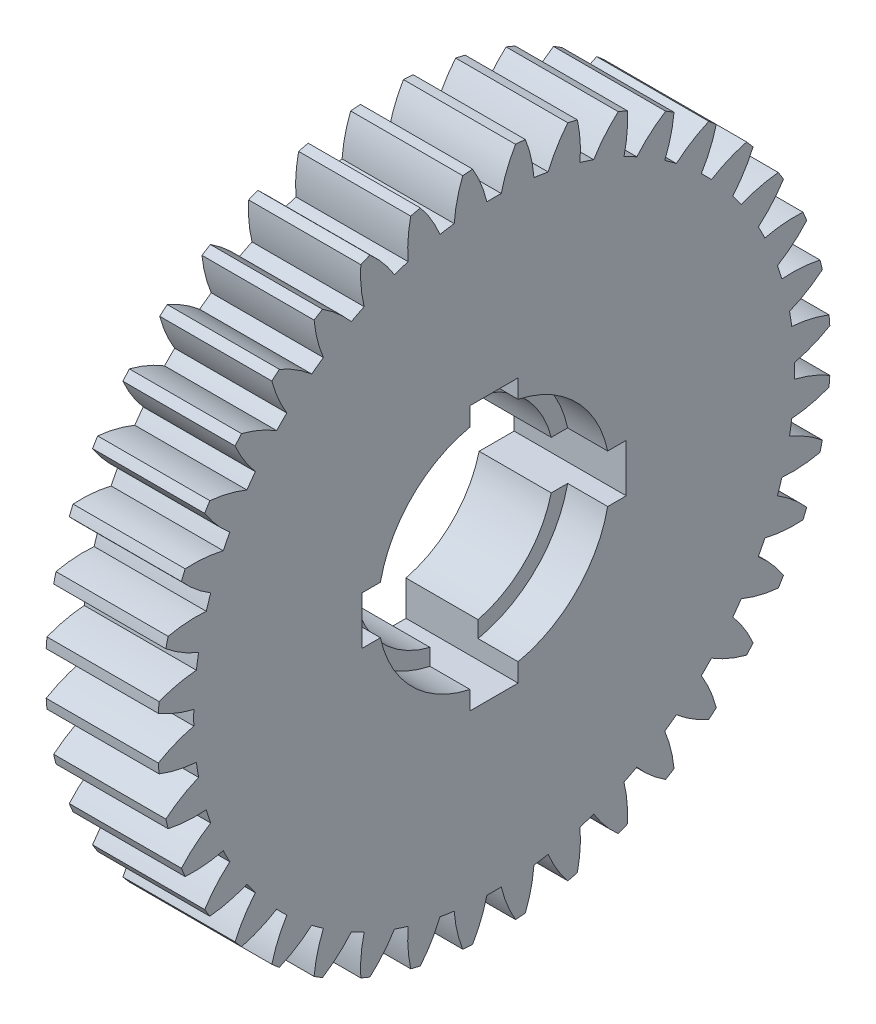
from build123d import *
from build123d.topology import SkipClean

# Parameters (mm, degrees)
BASPROSKE_W             = 8
BASPROSKE_H             = 21
TOOTHCUT_DEPTH          = 31.757112998
TEETHCUTS_COUNT         = 40
BORSKE_R                = 2.5
BORE_DEPTH              = 50.0000508
SKETCH1_R               = 30.395157115
CUT_EXTRUDE1_DEPTH      = 3
BOSS_EXTRUDE1_DEPTH     = 2
CUT_EXTRUDE2_DEPTH      = 31.056738792
CUT_EXTRUDE2_DEPTH_BACK = 31.056738792
CUT_EXTRUDE3_DEPTH      = 0.5
CUT_EXTRUDE3_DEPTH_BACK = 2
SKETCH3_R               = 7.25


with BuildPart() as part:
    # BasProSke → Base-Revolve (revolve)
    with BuildSketch(Plane(origin=(0, 0, 0), x_dir=(1, 0, 0), z_dir=(0, 1, 0))):
        with Locations((4, 10.5)):
            Rectangle(BASPROSKE_W, BASPROSKE_H)
    revolve(axis=Axis((-10, 0, 0), (1, 0, 0)))

    # TooCutSke → ToothCut (cut, through all)
    with BuildSketch(Plane(origin=(0, 0, 0), x_dir=(0, 0, -1), z_dir=(1, 0, 0))):
        with BuildLine():
            ThreePointArc((0.448673268, 18.74363074), (0, 18.749), (-0.448673268, 18.74363074))
            ThreePointArc((-0.448673268, 18.74363074), (-0.816786816, 19.89705013), (-1.354745081, 20.981708961))
            ThreePointArc((-1.354745081, 20.981708961), (0, 21.0254), (1.354745081, 20.981708961))
            ThreePointArc((1.354745081, 20.981708961), (0.816786816, 19.89705013), (0.448673268, 18.74363074))
        make_face()
    toothcut = extrude(amount=TOOTHCUT_DEPTH, mode=Mode.SUBTRACT)

    # TeethCuts: ToothCut ×40 about axis
    teethcuts_axis = Axis((-10, 0, 0), (1, 0, 0))
    for i in range(1, TEETHCUTS_COUNT):
        add(toothcut.rotate(teethcuts_axis, i * 360 / TEETHCUTS_COUNT), mode=Mode.SUBTRACT)

    # BorSke → Bore (cut, symmetric)
    with BuildSketch(Plane(origin=(0, 0, 0), x_dir=(0, 0, -1), z_dir=(1, 0, 0))):
        Circle(BORSKE_R)
    extrude(amount=BORE_DEPTH, both=True, mode=Mode.SUBTRACT)

    # Sketch1 → Cut-Extrude1 (cut)
    with BuildSketch(Plane(origin=(8, 0, 0), x_dir=(0, 0, -1), z_dir=(1, 0, 0))):
        with Locations((-0.364084054, 0)):
            Circle(SKETCH1_R)
    extrude(amount=-CUT_EXTRUDE1_DEPTH, mode=Mode.SUBTRACT)

    # Sketch4 → Boss-Extrude1 (add)
    with SkipClean():  # the faces are left unmerged after this step: merging them gives an invalid solid
        with BuildSketch(Plane(origin=(5, 0, 0), x_dir=(0, 0, -1), z_dir=(1, 0, 0))):
            with BuildLine():
                ThreePointArc((-20.908830043, 1.954693382), (-20.935264008, 1.64764101), (-20.957189063, 1.34023378))
                ThreePointArc((-20.957189063, 1.34023378), (-19.883840387, 0.811452619), (-18.74363074, 0.448673268))
                ThreePointArc((-18.74363074, 0.448673268), (-18.749, 0), (-18.74363074, -0.448673268))
                ThreePointArc((-18.74363074, -0.448673268), (-19.883840387, -0.811452619), (-20.957189063, -1.34023378))
                ThreePointArc((-20.957189063, -1.34023378), (-20.935264008, -1.64764101), (-20.908830043, -1.954693382))
                ThreePointArc((-20.908830043, -1.954693382), (-19.765976472, -2.309055643), (-18.583053504, -2.489000492))
                ThreePointArc((-18.583053504, -2.489000492), (-18.518168698, -2.932989785), (-18.442677579, -3.375299203))
                ThreePointArc((-18.442677579, -3.375299203), (-19.51209816, -3.911980225), (-20.489512535, -4.602159938))
                ThreePointArc((-20.489512535, -4.602159938), (-20.419768328, -4.902352641), (-20.345626236, -5.201489505))
                ThreePointArc((-20.345626236, -5.201489505), (-19.161408618, -5.372707292), (-17.964899819, -5.3653868))
                ThreePointArc((-17.964899819, -5.3653868), (-17.831358624, -5.793759628), (-17.687604489, -6.21881407))
                ThreePointArc((-17.687604489, -6.21881407), (-18.659903319, -6.916181894), (-19.517316207, -7.750765644))
                ThreePointArc((-19.517316207, -7.750765644), (-19.401470183, -8.03635208), (-19.281445587, -8.320207694))
                ThreePointArc((-19.281445587, -8.320207694), (-18.08502329, -8.304065056), (-16.904390677, -8.109659478))
                ThreePointArc((-16.904390677, -8.109659478), (-16.705481322, -8.51186788), (-16.497003875, -8.909201095))
                ThreePointArc((-16.497003875, -8.909201095), (-17.34823973, -9.750084211), (-18.06453878, -10.708521777))
                ThreePointArc((-18.06453878, -10.708521777), (-17.905443451, -10.972469859), (-17.742491756, -11.234054756))
                ThreePointArc((-17.742491756, -11.234054756), (-16.563324669, -11.030949179), (-15.427639334, -10.654245425))
                ThreePointArc((-15.427639334, -10.654245425), (-15.168259628, -11.020385695), (-14.900192275, -11.380214022))
                ThreePointArc((-14.900192275, -11.380214022), (-15.609404904, -12.343907097), (-16.166952456, -13.402598565))
                ThreePointArc((-16.166952456, -13.402598565), (-15.968525278, -13.638409015), (-15.766658895, -13.871282107))
                ThreePointArc((-15.766658895, -13.871282107), (-14.633782023, -13.486214724), (-13.57100831, -12.93648849))
                ThreePointArc((-13.57100831, -12.93648849), (-13.25754504, -13.25754504), (-12.93648849, -13.57100831))
                ThreePointArc((-12.93648849, -13.57100831), (-13.486214724, -14.633782023), (-13.871282107, -15.766658895))
                ThreePointArc((-13.871282107, -15.766658895), (-13.638409015, -15.968525278), (-13.402598565, -16.166952456))
                ThreePointArc((-13.402598565, -16.166952456), (-12.343907097, -15.609404904), (-11.380214022, -14.900192275))
                ThreePointArc((-11.380214022, -14.900192275), (-11.020385695, -15.168259628), (-10.654245425, -15.427639334))
                ThreePointArc((-10.654245425, -15.427639334), (-11.030949179, -16.563324669), (-11.234054756, -17.742491756))
                ThreePointArc((-11.234054756, -17.742491756), (-10.972469859, -17.905443451), (-10.708521777, -18.06453878))
                ThreePointArc((-10.708521777, -18.06453878), (-9.750084211, -17.34823973), (-8.909201095, -16.497003875))
                ThreePointArc((-8.909201095, -16.497003875), (-8.51186788, -16.705481322), (-8.109659478, -16.904390677))
                ThreePointArc((-8.109659478, -16.904390677), (-8.304065056, -18.08502329), (-8.320207694, -19.281445587))
                ThreePointArc((-8.320207694, -19.281445587), (-8.03635208, -19.401470183), (-7.750765644, -19.517316207))
                ThreePointArc((-7.750765644, -19.517316207), (-6.916181894, -18.659903319), (-6.21881407, -17.687604489))
                ThreePointArc((-6.21881407, -17.687604489), (-5.793759628, -17.831358624), (-5.3653868, -17.964899819))
                ThreePointArc((-5.3653868, -17.964899819), (-5.372707292, -19.161408618), (-5.201489505, -20.345626236))
                ThreePointArc((-5.201489505, -20.345626236), (-4.902352641, -20.419768328), (-4.602159938, -20.489512535))
                ThreePointArc((-4.602159938, -20.489512535), (-3.911980225, -19.51209816), (-3.375299203, -18.442677579))
                ThreePointArc((-3.375299203, -18.442677579), (-2.932989785, -18.518168698), (-2.489000492, -18.583053504))
                ThreePointArc((-2.489000492, -18.583053504), (-2.309055643, -19.765976472), (-1.954693382, -20.908830043))
                ThreePointArc((-1.954693382, -20.908830043), (-1.64764101, -20.935264008), (-1.34023378, -20.957189063))
                ThreePointArc((-1.34023378, -20.957189063), (-0.811452619, -19.883840387), (-0.448673268, -18.74363074))
                ThreePointArc((-0.448673268, -18.74363074), (0, -18.749), (0.448673268, -18.74363074))
                ThreePointArc((0.448673268, -18.74363074), (0.811452619, -19.883840387), (1.34023378, -20.957189063))
                ThreePointArc((1.34023378, -20.957189063), (1.64764101, -20.935264008), (1.954693382, -20.908830043))
                ThreePointArc((1.954693382, -20.908830043), (2.309055643, -19.765976472), (2.489000492, -18.583053504))
                ThreePointArc((2.489000492, -18.583053504), (2.932989785, -18.518168698), (3.375299203, -18.442677579))
                ThreePointArc((3.375299203, -18.442677579), (3.911980225, -19.51209816), (4.602159938, -20.489512535))
                ThreePointArc((4.602159938, -20.489512535), (4.902352641, -20.419768328), (5.201489505, -20.345626236))
                ThreePointArc((5.201489505, -20.345626236), (5.372707292, -19.161408618), (5.3653868, -17.964899819))
                ThreePointArc((5.3653868, -17.964899819), (5.793759628, -17.831358624), (6.21881407, -17.687604489))
                ThreePointArc((6.21881407, -17.687604489), (6.916181894, -18.659903319), (7.750765644, -19.517316207))
                ThreePointArc((7.750765644, -19.517316207), (8.03635208, -19.401470183), (8.320207694, -19.281445587))
                ThreePointArc((8.320207694, -19.281445587), (8.304065056, -18.08502329), (8.109659478, -16.904390677))
                ThreePointArc((8.109659478, -16.904390677), (8.51186788, -16.705481322), (8.909201095, -16.497003875))
                ThreePointArc((8.909201095, -16.497003875), (9.750084211, -17.34823973), (10.708521777, -18.06453878))
                ThreePointArc((10.708521777, -18.06453878), (10.972469859, -17.905443451), (11.234054756, -17.742491756))
                ThreePointArc((11.234054756, -17.742491756), (11.030949179, -16.563324669), (10.654245425, -15.427639334))
                ThreePointArc((10.654245425, -15.427639334), (11.020385695, -15.168259628), (11.380214022, -14.900192275))
                ThreePointArc((11.380214022, -14.900192275), (12.343907097, -15.609404904), (13.402598565, -16.166952456))
                ThreePointArc((13.402598565, -16.166952456), (13.638409015, -15.968525278), (13.871282107, -15.766658895))
                ThreePointArc((13.871282107, -15.766658895), (13.486214724, -14.633782023), (12.93648849, -13.57100831))
                ThreePointArc((12.93648849, -13.57100831), (13.25754504, -13.25754504), (13.57100831, -12.93648849))
                ThreePointArc((13.57100831, -12.93648849), (14.633782023, -13.486214724), (15.766658895, -13.871282107))
                ThreePointArc((15.766658895, -13.871282107), (15.968525278, -13.638409015), (16.166952456, -13.402598565))
                ThreePointArc((16.166952456, -13.402598565), (15.609404904, -12.343907097), (14.900192275, -11.380214022))
                ThreePointArc((14.900192275, -11.380214022), (15.168259628, -11.020385695), (15.427639334, -10.654245425))
                ThreePointArc((15.427639334, -10.654245425), (16.563324669, -11.030949179), (17.742491756, -11.234054756))
                ThreePointArc((17.742491756, -11.234054756), (17.905443451, -10.972469859), (18.06453878, -10.708521777))
                ThreePointArc((18.06453878, -10.708521777), (17.34823973, -9.750084211), (16.497003875, -8.909201095))
                ThreePointArc((16.497003875, -8.909201095), (16.705481322, -8.51186788), (16.904390677, -8.109659478))
                ThreePointArc((16.904390677, -8.109659478), (18.08502329, -8.304065056), (19.281445587, -8.320207694))
                ThreePointArc((19.281445587, -8.320207694), (19.401470183, -8.03635208), (19.517316207, -7.750765644))
                ThreePointArc((19.517316207, -7.750765644), (18.659903319, -6.916181894), (17.687604489, -6.21881407))
                ThreePointArc((17.687604489, -6.21881407), (17.831358624, -5.793759628), (17.964899819, -5.3653868))
                ThreePointArc((17.964899819, -5.3653868), (19.161408618, -5.372707292), (20.345626236, -5.201489505))
                ThreePointArc((20.345626236, -5.201489505), (20.419768328, -4.902352641), (20.489512535, -4.602159938))
                ThreePointArc((20.489512535, -4.602159938), (19.51209816, -3.911980225), (18.442677579, -3.375299203))
                ThreePointArc((18.442677579, -3.375299203), (18.518168698, -2.932989785), (18.583053504, -2.489000492))
                ThreePointArc((18.583053504, -2.489000492), (19.765976472, -2.309055643), (20.908830043, -1.954693382))
                ThreePointArc((20.908830043, -1.954693382), (20.935264008, -1.64764101), (20.957189063, -1.34023378))
                ThreePointArc((20.957189063, -1.34023378), (19.883840387, -0.811452619), (18.74363074, -0.448673268))
                ThreePointArc((18.74363074, -0.448673268), (18.749, 0), (18.74363074, 0.448673268))
                ThreePointArc((18.74363074, 0.448673268), (19.883840387, 0.811452619), (20.957189063, 1.34023378))
                ThreePointArc((20.957189063, 1.34023378), (20.935264008, 1.64764101), (20.908830043, 1.954693382))
                ThreePointArc((20.908830043, 1.954693382), (19.765976472, 2.309055643), (18.583053504, 2.489000492))
                ThreePointArc((18.583053504, 2.489000492), (18.518168698, 2.932989785), (18.442677579, 3.375299203))
                ThreePointArc((18.442677579, 3.375299203), (19.51209816, 3.911980225), (20.489512535, 4.602159938))
                ThreePointArc((20.489512535, 4.602159938), (20.419768328, 4.902352641), (20.345626236, 5.201489505))
                ThreePointArc((20.345626236, 5.201489505), (19.161408618, 5.372707292), (17.964899819, 5.3653868))
                ThreePointArc((17.964899819, 5.3653868), (17.831358624, 5.793759628), (17.687604489, 6.21881407))
                ThreePointArc((17.687604489, 6.21881407), (18.659903319, 6.916181894), (19.517316207, 7.750765644))
                ThreePointArc((19.517316207, 7.750765644), (19.401470183, 8.03635208), (19.281445587, 8.320207694))
                ThreePointArc((19.281445587, 8.320207694), (18.08502329, 8.304065056), (16.904390677, 8.109659478))
                ThreePointArc((16.904390677, 8.109659478), (16.705481322, 8.51186788), (16.497003875, 8.909201095))
                ThreePointArc((16.497003875, 8.909201095), (17.34823973, 9.750084211), (18.06453878, 10.708521777))
                ThreePointArc((18.06453878, 10.708521777), (17.905443451, 10.972469859), (17.742491756, 11.234054756))
                ThreePointArc((17.742491756, 11.234054756), (16.563324669, 11.030949179), (15.427639334, 10.654245425))
                ThreePointArc((15.427639334, 10.654245425), (15.168259628, 11.020385695), (14.900192275, 11.380214022))
                ThreePointArc((14.900192275, 11.380214022), (15.609404904, 12.343907097), (16.166952456, 13.402598565))
                ThreePointArc((16.166952456, 13.402598565), (15.968525278, 13.638409015), (15.766658895, 13.871282107))
                ThreePointArc((15.766658895, 13.871282107), (14.633782023, 13.486214724), (13.57100831, 12.93648849))
                ThreePointArc((13.57100831, 12.93648849), (13.25754504, 13.25754504), (12.93648849, 13.57100831))
                ThreePointArc((12.93648849, 13.57100831), (13.486214724, 14.633782023), (13.871282107, 15.766658895))
                ThreePointArc((13.871282107, 15.766658895), (13.638409015, 15.968525278), (13.402598565, 16.166952456))
                ThreePointArc((13.402598565, 16.166952456), (12.343907097, 15.609404904), (11.380214022, 14.900192275))
                ThreePointArc((11.380214022, 14.900192275), (11.020385695, 15.168259628), (10.654245425, 15.427639334))
                ThreePointArc((10.654245425, 15.427639334), (11.030949179, 16.563324669), (11.234054756, 17.742491756))
                ThreePointArc((11.234054756, 17.742491756), (10.972469859, 17.905443451), (10.708521777, 18.06453878))
                ThreePointArc((10.708521777, 18.06453878), (9.750084211, 17.34823973), (8.909201095, 16.497003875))
                ThreePointArc((8.909201095, 16.497003875), (8.51186788, 16.705481322), (8.109659478, 16.904390677))
                ThreePointArc((8.109659478, 16.904390677), (8.304065056, 18.08502329), (8.320207694, 19.281445587))
                ThreePointArc((8.320207694, 19.281445587), (8.03635208, 19.401470183), (7.750765644, 19.517316207))
                ThreePointArc((7.750765644, 19.517316207), (6.916181894, 18.659903319), (6.21881407, 17.687604489))
                ThreePointArc((6.21881407, 17.687604489), (5.793759628, 17.831358624), (5.3653868, 17.964899819))
                ThreePointArc((5.3653868, 17.964899819), (5.372707292, 19.161408618), (5.201489505, 20.345626236))
                ThreePointArc((5.201489505, 20.345626236), (4.902352641, 20.419768328), (4.602159938, 20.489512535))
                ThreePointArc((4.602159938, 20.489512535), (3.911980225, 19.51209816), (3.375299203, 18.442677579))
                ThreePointArc((3.375299203, 18.442677579), (2.932989785, 18.518168698), (2.489000492, 18.583053504))
                ThreePointArc((2.489000492, 18.583053504), (2.309055643, 19.765976472), (1.954693382, 20.908830043))
                ThreePointArc((1.954693382, 20.908830043), (1.64764101, 20.935264008), (1.34023378, 20.957189063))
                ThreePointArc((1.34023378, 20.957189063), (0.811452619, 19.883840387), (0.448673268, 18.74363074))
                ThreePointArc((0.448673268, 18.74363074), (0, 18.749), (-0.448673268, 18.74363074))
                ThreePointArc((-0.448673268, 18.74363074), (-0.811452619, 19.883840387), (-1.34023378, 20.957189063))
                ThreePointArc((-1.34023378, 20.957189063), (-1.64764101, 20.935264008), (-1.954693382, 20.908830043))
                ThreePointArc((-1.954693382, 20.908830043), (-2.309055643, 19.765976472), (-2.489000492, 18.583053504))
                ThreePointArc((-2.489000492, 18.583053504), (-2.932989785, 18.518168698), (-3.375299203, 18.442677579))
                ThreePointArc((-3.375299203, 18.442677579), (-3.911980225, 19.51209816), (-4.602159938, 20.489512535))
                ThreePointArc((-4.602159938, 20.489512535), (-4.902352641, 20.419768328), (-5.201489505, 20.345626236))
                ThreePointArc((-5.201489505, 20.345626236), (-5.372707292, 19.161408618), (-5.3653868, 17.964899819))
                ThreePointArc((-5.3653868, 17.964899819), (-5.793759628, 17.831358624), (-6.21881407, 17.687604489))
                ThreePointArc((-6.21881407, 17.687604489), (-6.916181894, 18.659903319), (-7.750765644, 19.517316207))
                ThreePointArc((-7.750765644, 19.517316207), (-8.03635208, 19.401470183), (-8.320207694, 19.281445587))
                ThreePointArc((-8.320207694, 19.281445587), (-8.304065056, 18.08502329), (-8.109659478, 16.904390677))
                ThreePointArc((-8.109659478, 16.904390677), (-8.51186788, 16.705481322), (-8.909201095, 16.497003875))
                ThreePointArc((-8.909201095, 16.497003875), (-9.750084211, 17.34823973), (-10.708521777, 18.06453878))
                ThreePointArc((-10.708521777, 18.06453878), (-10.972469859, 17.905443451), (-11.234054756, 17.742491756))
                ThreePointArc((-11.234054756, 17.742491756), (-11.030949179, 16.563324669), (-10.654245425, 15.427639334))
                ThreePointArc((-10.654245425, 15.427639334), (-11.020385695, 15.168259628), (-11.380214022, 14.900192275))
                ThreePointArc((-11.380214022, 14.900192275), (-12.343907097, 15.609404904), (-13.402598565, 16.166952456))
                ThreePointArc((-13.402598565, 16.166952456), (-13.638409015, 15.968525278), (-13.871282107, 15.766658895))
                ThreePointArc((-13.871282107, 15.766658895), (-13.486214724, 14.633782023), (-12.93648849, 13.57100831))
                ThreePointArc((-12.93648849, 13.57100831), (-13.25754504, 13.25754504), (-13.57100831, 12.93648849))
                ThreePointArc((-13.57100831, 12.93648849), (-14.633782023, 13.486214724), (-15.766658895, 13.871282107))
                ThreePointArc((-15.766658895, 13.871282107), (-15.968525278, 13.638409015), (-16.166952456, 13.402598565))
                ThreePointArc((-16.166952456, 13.402598565), (-15.609404904, 12.343907097), (-14.900192275, 11.380214022))
                ThreePointArc((-14.900192275, 11.380214022), (-15.168259628, 11.020385695), (-15.427639334, 10.654245425))
                ThreePointArc((-15.427639334, 10.654245425), (-16.563324669, 11.030949179), (-17.742491756, 11.234054756))
                ThreePointArc((-17.742491756, 11.234054756), (-17.905443451, 10.972469859), (-18.06453878, 10.708521777))
                ThreePointArc((-18.06453878, 10.708521777), (-17.34823973, 9.750084211), (-16.497003875, 8.909201095))
                ThreePointArc((-16.497003875, 8.909201095), (-16.705481322, 8.51186788), (-16.904390677, 8.109659478))
                ThreePointArc((-16.904390677, 8.109659478), (-18.08502329, 8.304065056), (-19.281445587, 8.320207694))
                ThreePointArc((-19.281445587, 8.320207694), (-19.401470183, 8.03635208), (-19.517316207, 7.750765644))
                ThreePointArc((-19.517316207, 7.750765644), (-18.659903319, 6.916181894), (-17.687604489, 6.21881407))
                ThreePointArc((-17.687604489, 6.21881407), (-17.831358624, 5.793759628), (-17.964899819, 5.3653868))
                ThreePointArc((-17.964899819, 5.3653868), (-19.161408618, 5.372707292), (-20.345626236, 5.201489505))
                ThreePointArc((-20.345626236, 5.201489505), (-20.419768328, 4.902352641), (-20.489512535, 4.602159938))
                ThreePointArc((-20.489512535, 4.602159938), (-19.51209816, 3.911980225), (-18.442677579, 3.375299203))
                ThreePointArc((-18.442677579, 3.375299203), (-18.518168698, 2.932989785), (-18.583053504, 2.489000492))
                ThreePointArc((-18.583053504, 2.489000492), (-19.765976472, 2.309055643), (-20.908830043, 1.954693382))
            make_face()
        extrude(amount=BOSS_EXTRUDE1_DEPTH)

    # Sketch2 → Cut-Extrude2 (cut, two sides: drawn at the far end of the back side and taken through both)
    with SkipClean():  # the faces are left unmerged after this step: merging them gives an invalid solid
        with BuildSketch(Plane.ZY.offset(-5).offset(-CUT_EXTRUDE2_DEPTH_BACK)):
            with BuildLine():
                Line((-1.5, 8.25), (1.5, 8.25))
                Line((1.5, 8.25), (1.5, 6.06733055))
                ThreePointArc((1.5, 6.06733055), (4.419417382, 4.419417382), (6.06733055, 1.5))
                Line((6.06733055, 1.5), (8.25, 1.5))
                Line((8.25, 1.5), (8.25, -1.5))
                Line((8.25, -1.5), (6.06733055, -1.5))
                ThreePointArc((6.06733055, -1.5), (4.419417382, -4.419417382), (1.5, -6.06733055))
                Line((1.5, -6.06733055), (1.5, -8.25))
                Line((1.5, -8.25), (-1.5, -8.25))
                Line((-1.5, -8.25), (-1.5, -6.06733055))
                ThreePointArc((-1.5, -6.06733055), (-4.419417382, -4.419417382), (-6.06733055, -1.5))
                Line((-6.06733055, -1.5), (-8.25, -1.5))
                Line((-8.25, -1.5), (-8.25, 1.5))
                Line((-8.25, 1.5), (-6.06733055, 1.5))
                ThreePointArc((-6.06733055, 1.5), (-4.419417382, 4.419417382), (-1.5, 6.06733055))
                Line((-1.5, 6.06733055), (-1.5, 8.25))
            make_face()
        extrude(amount=CUT_EXTRUDE2_DEPTH + CUT_EXTRUDE2_DEPTH_BACK, mode=Mode.SUBTRACT)

    # Sketch3 → Cut-Extrude3 (cut, two sides: drawn at the far end of the back side and taken through both)
    with SkipClean():  # the faces are left unmerged after this step: merging them gives an invalid solid
        with BuildSketch(Plane.ZY.offset(-5).offset(-CUT_EXTRUDE3_DEPTH_BACK)):
            Circle(SKETCH3_R)
        extrude(amount=CUT_EXTRUDE3_DEPTH + CUT_EXTRUDE3_DEPTH_BACK, mode=Mode.SUBTRACT)


solid = part.part
